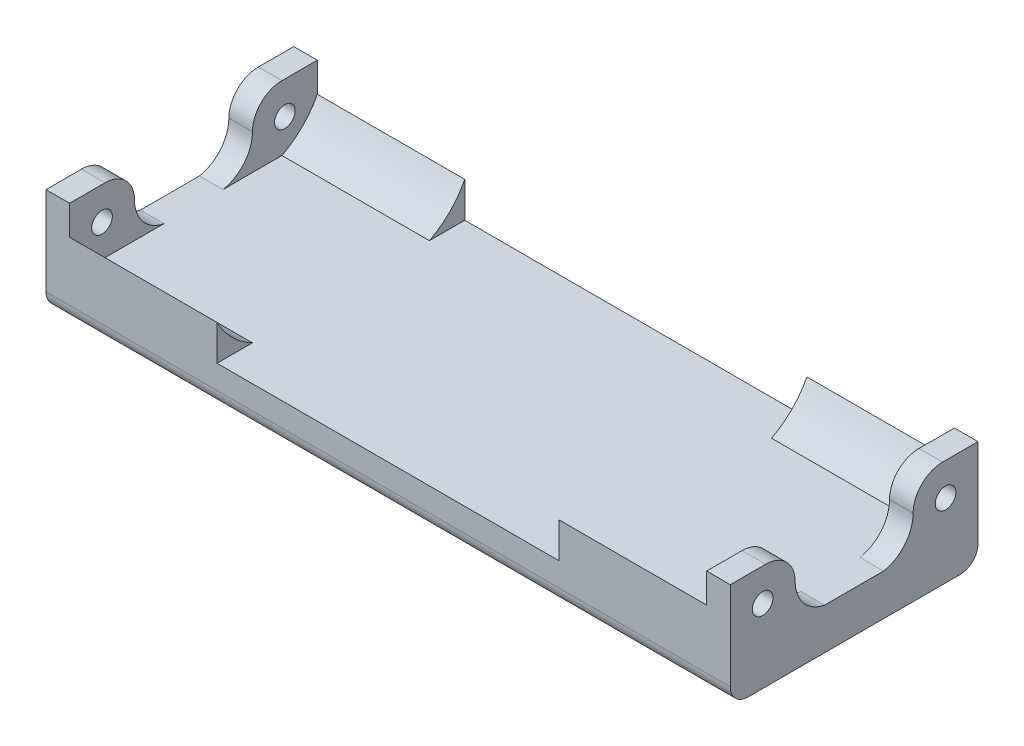
from build123d import *

# Parameters (mm, degrees)
SKETCH1_W                       = 116
SKETCH1_H                       = 42
BOSS_EXTRUDE1_DEPTH             = 7
BOSS_EXTRUDE2_REACH             = 64.081
SKETCH2_R                       = 1.75
BOSS_EXTRUDE2_DIRECTION_2_REACH = 64.081
SKETCH2_3_R                     = 1.75
CUT_EXTRUDE1_DEPTH              = 54
BOSS_EXTRUDE3_DEPTH             = 25
FILLET1_R                       = 3


with BuildPart() as part:
    # Sketch1 → Boss-Extrude1 (new body)
    with BuildSketch(Plane(origin=(0, 0, 0), x_dir=(1, 0, 0), z_dir=(0, 1, 0))):
        Rectangle(SKETCH1_W, SKETCH1_H)
    extrude(amount=BOSS_EXTRUDE1_DEPTH)

    # Boss-Extrude2: up to this face of the body (flat: up to its plane)
    boss_extrude2_end = Plane(part.part.faces().sort_by_distance((58, 3.5, 0))[0])
    # Sketch2 → Boss-Extrude2 (add, up to the picked face)
    with BuildSketch(Plane(origin=(0, 0, 0), x_dir=(0, 0, -1), z_dir=(1, 0, 0)), mode=Mode.PRIVATE) as boss_extrude2_sk1:
        with BuildLine():
            Line((-21, 18), (-21, 7))
            Line((-21, 7), (-5, 7))
            ThreePointArc((-5, 7), (-8.586149806, 9.094875162), (-10, 13))
            ThreePointArc((-10, 13), (-11.464466094, 16.535533906), (-15, 18))
            Line((-15, 18), (-21, 18))
        make_face()
        with Locations((-15.5, 12.475)):
            Circle(SKETCH2_R, mode=Mode.SUBTRACT)
    boss_extrude2_tool1 = split(extrude(boss_extrude2_sk1.sketch, amount=BOSS_EXTRUDE2_REACH, mode=Mode.PRIVATE), bisect_by=boss_extrude2_end, keep=Keep.BOTH, mode=Mode.PRIVATE)
    # Sketch2 → Boss-Extrude2 (add, up to the picked face)
    with BuildSketch(Plane(origin=(0, 0, 0), x_dir=(0, 0, -1), z_dir=(1, 0, 0)), mode=Mode.PRIVATE) as boss_extrude2_sk2:
        with BuildLine():
            ThreePointArc((10, 13), (8.586149806, 9.094875162), (5, 7))
            Line((5, 7), (21, 7))
            Line((21, 7), (21, 18))
            Line((21, 18), (15, 18))
            ThreePointArc((15, 18), (11.464466094, 16.535533906), (10, 13))
        make_face()
        with Locations((15.5, 12.475)):
            Circle(SKETCH2_R, mode=Mode.SUBTRACT)
    boss_extrude2_tool2 = split(extrude(boss_extrude2_sk2.sketch, amount=BOSS_EXTRUDE2_REACH, mode=Mode.PRIVATE), bisect_by=boss_extrude2_end, keep=Keep.BOTH, mode=Mode.PRIVATE)
    add(boss_extrude2_tool1.solids().sort_by(Axis((0, 12.5, 20.805835), (1, 0, 0)))[0])
    add(boss_extrude2_tool2.solids().sort_by(Axis((0, 12.5, -20.805835), (1, 0, 0)))[0])

    # Boss-Extrude2 direction 2: up to this face of the body (flat: up to its plane)
    boss_extrude2_direction_2_end = Plane(part.part.faces().sort_by_distance((-58, 3.5, 0))[0])
    # Sketch2 → Boss-Extrude2 direction 2 (add, up to the picked face)
    with BuildSketch(Plane(origin=(0, 0, 0), x_dir=(0, 0, -1), z_dir=(1, 0, 0)), mode=Mode.PRIVATE) as boss_extrude2_direction_2_sk1:
        with BuildLine():
            Line((-21, 18), (-21, 7))
            Line((-21, 7), (-5, 7))
            ThreePointArc((-5, 7), (-8.586149806, 9.094875162), (-10, 13))
            ThreePointArc((-10, 13), (-11.464466094, 16.535533906), (-15, 18))
            Line((-15, 18), (-21, 18))
        make_face()
        with Locations((-15.5, 12.475)):
            Circle(SKETCH2_R, mode=Mode.SUBTRACT)
    boss_extrude2_direction_2_tool1 = split(extrude(boss_extrude2_direction_2_sk1.sketch, amount=-BOSS_EXTRUDE2_DIRECTION_2_REACH, mode=Mode.PRIVATE), bisect_by=boss_extrude2_direction_2_end, keep=Keep.BOTH, mode=Mode.PRIVATE)
    # Sketch2 → Boss-Extrude2 direction 2 (add, up to the picked face)
    with BuildSketch(Plane(origin=(0, 0, 0), x_dir=(0, 0, -1), z_dir=(1, 0, 0)), mode=Mode.PRIVATE) as boss_extrude2_direction_2_sk2:
        with BuildLine():
            ThreePointArc((10, 13), (8.586149806, 9.094875162), (5, 7))
            Line((5, 7), (21, 7))
            Line((21, 7), (21, 18))
            Line((21, 18), (15, 18))
            ThreePointArc((15, 18), (11.464466094, 16.535533906), (10, 13))
        make_face()
        with Locations((15.5, 12.475)):
            Circle(SKETCH2_R, mode=Mode.SUBTRACT)
    boss_extrude2_direction_2_tool2 = split(extrude(boss_extrude2_direction_2_sk2.sketch, amount=-BOSS_EXTRUDE2_DIRECTION_2_REACH, mode=Mode.PRIVATE), bisect_by=boss_extrude2_direction_2_end, keep=Keep.BOTH, mode=Mode.PRIVATE)
    add(boss_extrude2_direction_2_tool1.solids().sort_by(Axis((0, 12.5, 20.805835), (-1, 0, 0)))[0])
    add(boss_extrude2_direction_2_tool2.solids().sort_by(Axis((0, 12.5, -20.805835), (-1, 0, 0)))[0])

    # Sketch2<3> → Cut-Extrude1 (cut, symmetric)
    # profile 1 of 2: a face of its own
    with BuildSketch(Plane(origin=(0, 0, 0), x_dir=(0, 0, -1), z_dir=(1, 0, 0))):
        with BuildLine():
            Line((-21, 18), (-21, 7))
            Line((-21, 7), (-5, 7))
            ThreePointArc((-5, 7), (-8.586149806, 9.094875162), (-10, 13))
            ThreePointArc((-10, 13), (-11.464466094, 16.535533906), (-15, 18))
            Line((-15, 18), (-21, 18))
        make_face()
        with Locations((-15.5, 12.475)):
            Circle(SKETCH2_3_R, mode=Mode.SUBTRACT)
    # profile 2 of 2: a face of its own
    with BuildSketch(Plane(origin=(0, 0, 0), x_dir=(0, 0, -1), z_dir=(1, 0, 0))):
        with BuildLine():
            ThreePointArc((10, 13), (8.586149806, 9.094875162), (5, 7))
            Line((5, 7), (21, 7))
            Line((21, 7), (21, 18))
            Line((21, 18), (15, 18))
            ThreePointArc((15, 18), (11.464466094, 16.535533906), (10, 13))
        make_face()
        with Locations((15.5, 12.475)):
            Circle(SKETCH2_3_R, mode=Mode.SUBTRACT)
    extrude(amount=CUT_EXTRUDE1_DEPTH, both=True, mode=Mode.SUBTRACT)

    # Sketch3 → Boss-Extrude3 (add)
    with BuildSketch(Plane(origin=(-54, 0, 0), x_dir=(0, 0, -1), z_dir=(1, 0, 0))):
        with BuildLine():
            Line((-21, 7), (-15, 7))
            ThreePointArc((-15, 7), (-18.465513805, 9.534486195), (-21, 13))
            Line((-21, 13), (-21, 7))
        make_face()
        with BuildLine():
            Line((21, 7), (21, 13))
            ThreePointArc((21, 13), (18.465513805, 9.534486195), (15, 7))
            Line((15, 7), (21, 7))
        make_face()
    boss_extrude3 = extrude(amount=BOSS_EXTRUDE3_DEPTH)

    # Mirror4: Boss-Extrude3 across plane
    add(boss_extrude3.mirror(Plane(origin=(0, 0, 0), x_dir=(0, 0, 1), z_dir=(1, 0, 0))))

    # Fillet1
    fillet1_edges = [part.edges().sort_by_distance(p)[0] for p in [
        (0, 0, 21),
        (0, 0, -21),
    ]]
    fillet(fillet1_edges, radius=FILLET1_R)


solid = part.part
